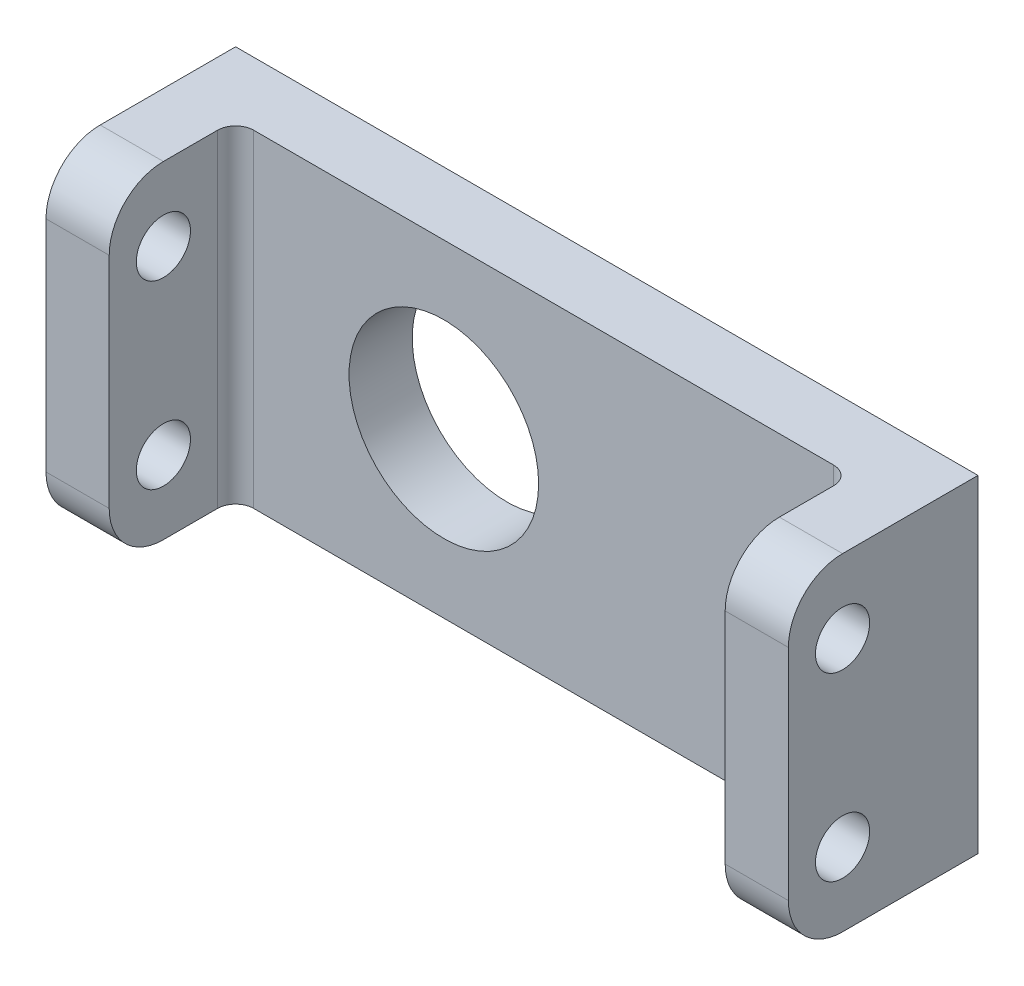
from build123d import *

# Parameters (mm, degrees)
SKETCH_1_W               = 41.11
SKETCH_1_H               = 18.14
SKETCH_1_R               = 5.25
EXTRUDE_1_DEPTH          = 3.5
SKETCH_3_W               = 3.5
SKETCH_3_H               = 18.14
EXTRUDE_2_DEPTH          = 7
CUT_EXTRUDE_1_DEPTH      = 45.116640965
CUT_EXTRUDE_1_DEPTH_BACK = 45.116640965
SKETCH_4_R               = 1.5
FILLET_1_R               = 1
FILLET_2_R               = 3


with BuildPart() as part:
    # 草图1 → 凸台-拉伸1 (new body)
    with BuildSketch(Plane.XY):
        with Locations((-11.958959751, -3.012876727)):
            Rectangle(SKETCH_1_W, SKETCH_1_H)
        with Locations((-17.483959751, -3.012876727)):
            Circle(SKETCH_1_R, mode=Mode.SUBTRACT)
    extrude(amount=EXTRUDE_1_DEPTH)

    # 草图3 → 凸台-拉伸2 (add)
    with BuildSketch(Plane.XY.offset(3.5)):
        with Locations((-30.763959751, -3.012876727)):
            Rectangle(SKETCH_3_W, SKETCH_3_H)
        with Locations((6.846040249, -3.012876727)):
            Rectangle(SKETCH_3_W, SKETCH_3_H)
    extrude(amount=EXTRUDE_2_DEPTH)

    # 草图4 → 切除-拉伸1 (cut, two sides: drawn at the far end of the back side and taken through both)
    with BuildSketch(Plane(origin=(8.596040249, 0, 0), x_dir=(0, 0, -1), z_dir=(1, 0, 0)).offset(-CUT_EXTRUDE_1_DEPTH_BACK)):
        with Locations(Location((-7.5, 1.987123273, 0), (0, 0, 90))):
            Circle(SKETCH_4_R)
        with Locations(Location((-7.5, -8.012876727, 0), (0, 0, 90))):
            Circle(SKETCH_4_R)
    extrude(amount=CUT_EXTRUDE_1_DEPTH + CUT_EXTRUDE_1_DEPTH_BACK, mode=Mode.SUBTRACT)

    # 圆角1
    fillet_1_edges = [part.edges().sort_by_distance(p)[0] for p in [
        (-29.013959751, -3.012876727, 3.5),
        (5.096040249, -3.012876727, 3.5),
    ]]
    fillet(fillet_1_edges, radius=FILLET_1_R)

    # 圆角2
    fillet_2_edges = [part.edges().sort_by_distance(p)[0] for p in [
        (-30.763959751, -12.082876727, 10.5),
        (-30.763959751, 6.057123273, 10.5),
        (6.846040249, 6.057123273, 10.5),
        (6.846040249, -12.082876727, 10.5),
    ]]
    fillet(fillet_2_edges, radius=FILLET_2_R)


solid = part.part
